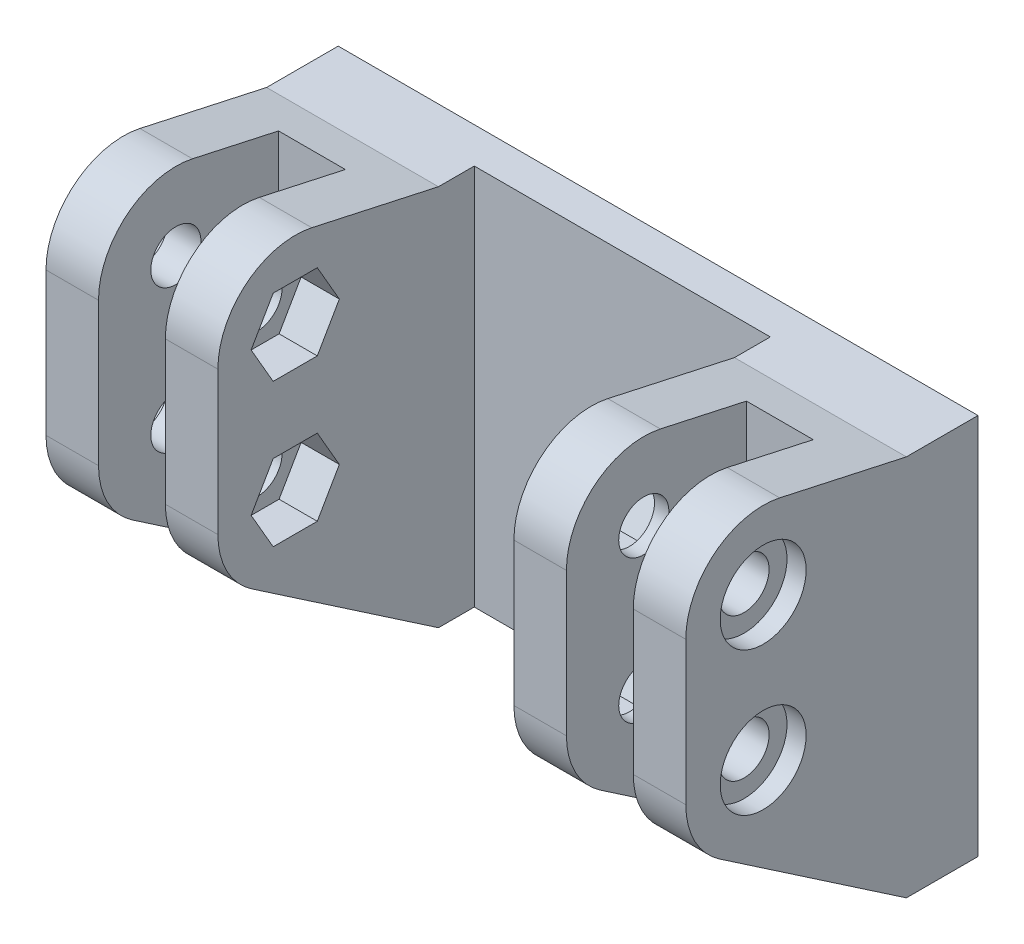
from build123d import *
from build123d.topology import SkipClean

# Parameters (mm, degrees)
SKETCH1_R               = 2.625
BOSS_EXTRUDE1_DEPTH     = 18
SKETCH2_W               = 3.75
SKETCH2_H               = 40
BOSS_EXTRUDE2_DEPTH     = 15.5
CUT_EXTRUDE2_DEPTH      = 3.5
CUT_EXTRUDE2_DEPTH_BACK = 3.5
SKETCH4_W               = 26.185074211
SKETCH4_H               = 43.492971865
CUT_EXTRUDE3_DEPTH      = 3.75
CUT_EXTRUDE4_DEPTH      = 4
SKETCH6_R               = 4.5
CUT_EXTRUDE5_DEPTH      = 2


with BuildPart() as part:
    # Sketch1 → Boss-Extrude1 (new body)
    with BuildSketch(Plane(origin=(0, 0, 0), x_dir=(0, 0, -1), z_dir=(1, 0, 0))):
        with BuildLine():
            Line((0, 0), (5, 0))
            Line((5, 0), (5, 40))
            Line((5, 40), (0, 40))
            Line((0, 40), (-2.5, 40))
            Line((-2.5, 40), (-15.763202528, 42.911607583))
            ThreePointArc((-15.763202528, 42.911607583), (-22.576511621, 41.311816677), (-25.6, 35))
            Line((-25.6, 35), (-25.6, 20))
            ThreePointArc((-25.6, 20), (-24.659331675, 16.211336651), (-22.055809883, 13.302642588))
            Line((-22.055809883, 13.302642588), (-2.5, 0))
            Line((-2.5, 0), (0, 0))
        make_face()
        with Locations((-17.5, 35)):
            Circle(SKETCH1_R, mode=Mode.SUBTRACT)
        with Locations((-17.5, 20)):
            Circle(SKETCH1_R, mode=Mode.SUBTRACT)
    extrude(amount=BOSS_EXTRUDE1_DEPTH)

    # Sketch2 → Boss-Extrude2 (add)
    with BuildSketch(Plane.ZY):
        with Locations((-3.125, 20)):
            Rectangle(SKETCH2_W, SKETCH2_H)
    extrude(amount=BOSS_EXTRUDE2_DEPTH)

    # Sketch4 → Cut-Extrude2 (cut, two sides: drawn at the far end of the back side and taken through both)
    with BuildSketch(Plane(origin=(9, 0, 0), x_dir=(0, 0, -1), z_dir=(1, 0, 0)).offset(-CUT_EXTRUDE2_DEPTH_BACK)):
        with Locations((-19.842537105, 21.746485933)):
            Rectangle(SKETCH4_W, SKETCH4_H)
    extrude(amount=CUT_EXTRUDE2_DEPTH + CUT_EXTRUDE2_DEPTH_BACK, mode=Mode.SUBTRACT)

    # Sketch5 → Cut-Extrude3 (cut)
    with BuildSketch(Plane.XY.offset(-1.25)):
        with BuildLine():
            Line((-15.5, 23.302), (-15.5, 16.698))
            ThreePointArc((-15.5, 16.698), (-12.198, 20), (-15.5, 23.302))
        make_face()
    extrude(amount=-CUT_EXTRUDE3_DEPTH, mode=Mode.SUBTRACT)

    # Sketch3 → Cut-Extrude4 (cut)
    with BuildSketch(Plane(origin=(0, 0, 0), x_dir=(0, 0, -1), z_dir=(1, 0, 0))):
        Polygon((-12.881197846, 35), (-15.190598923, 39), (-19.809401077, 39), (-22.118802154, 35), (-19.809401077, 31), (-15.190598923, 31), align=None)
        Polygon((-12.881197846, 20), (-15.190598923, 24), (-19.809401077, 24), (-22.118802154, 20), (-19.809401077, 16), (-15.190598923, 16), align=None)
    extrude(amount=CUT_EXTRUDE4_DEPTH, mode=Mode.SUBTRACT)

    # Sketch6 → Cut-Extrude5 (cut)
    with BuildSketch(Plane(origin=(18, 0, 0), x_dir=(0, 0, -1), z_dir=(1, 0, 0))):
        with Locations((-17.5, 20)):
            Circle(SKETCH6_R)
        with Locations((-17.5, 35)):
            Circle(SKETCH6_R)
    extrude(amount=-CUT_EXTRUDE5_DEPTH, mode=Mode.SUBTRACT)

    # Mirror2: part across plane


with BuildPart() as part_1:
    with SkipClean():  # the faces are left unmerged after this step: merging them gives an invalid solid
        add(part.part)
        add(part.part.mirror(Plane(origin=(-15.5, 0, 0), x_dir=(0, 0, 1), z_dir=(1, 0, 0))))


solid = part_1.part
